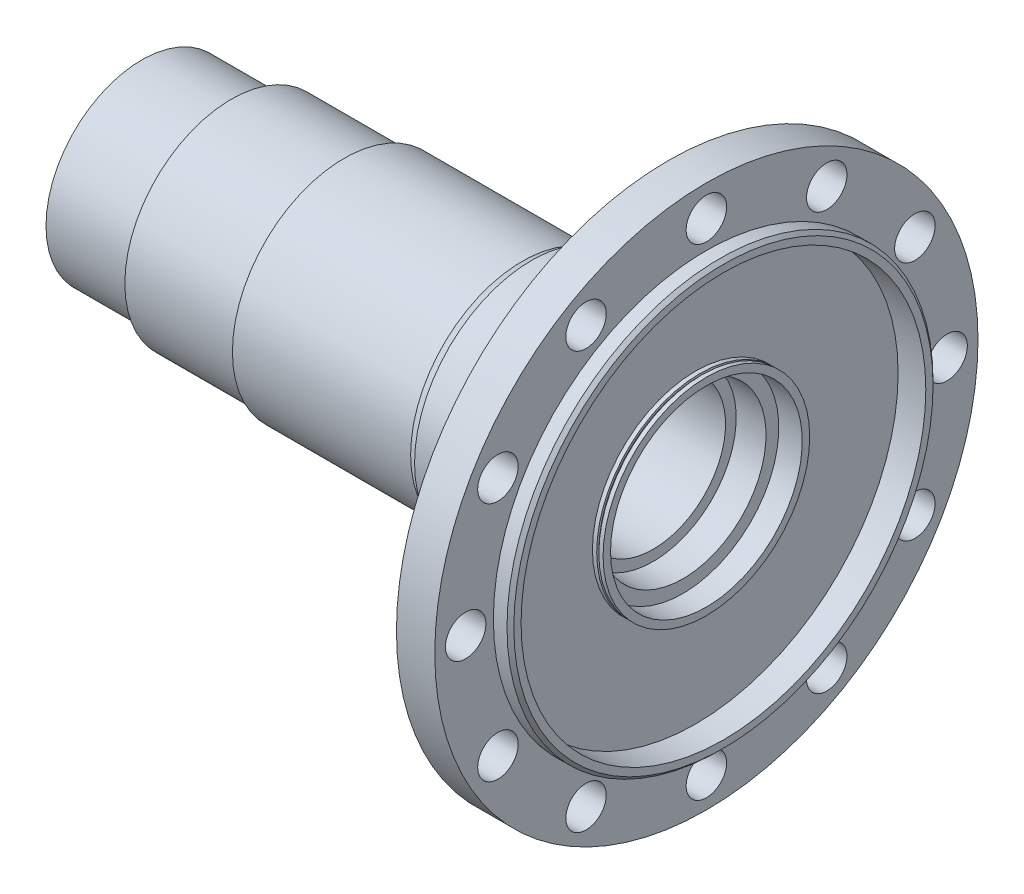
from build123d import *

# Parameters (mm, degrees)
SKETCH_3_W           = 2
SKETCH_3_H           = 46.5
SKETCH_4_W           = 1
SKETCH_4_H           = 47.5
SKETCH_5_W           = 2
SKETCH_5_H           = 46.5
SKETCH_6_R           = 9.5
CUT_EXTRUDE_1_DEPTH  = 328.171973127
SKETCH_7_R           = 9.5
CUT_EXTRUDE_2_DEPTH  = 328.171973127
SKETCH_8_R           = 9.5
CUT_EXTRUDE_3_DEPTH  = 328.171973127
SKETCH_9_R           = 9.5
CUT_EXTRUDE_4_DEPTH  = 328.171973127
SKETCH_10_R          = 9.5
CUT_EXTRUDE_5_DEPTH  = 328.171973127
SKETCH_11_R          = 9.5
CUT_EXTRUDE_6_DEPTH  = 328.171973127
SKETCH_12_R          = 9.5
CUT_EXTRUDE_7_DEPTH  = 328.171973127
SKETCH_13_R          = 9.5
CUT_EXTRUDE_8_DEPTH  = 328.171973127
SKETCH_14_R          = 9.5
CUT_EXTRUDE_9_DEPTH  = 328.171973127
SKETCH_15_R          = 9.5
CUT_EXTRUDE_10_DEPTH = 328.171973127
SKETCH_16_R          = 9.5
CUT_EXTRUDE_11_DEPTH = 328.171973127
SKETCH_17_R          = 9.5
CUT_EXTRUDE_12_DEPTH = 328.171973127


with BuildPart() as part:
    # Эскиз1 → Повернуть1 (revolve)
    with BuildSketch(Plane.XY, mode=Mode.PRIVATE) as revolve_1_sk:
        Polygon((0, 0), (273, 0), (273, 98.4), (271.4, 100), (265, 100), (265, 127.5), (247, 127.5), (247, 100), (239, 100), (239, 62.5), (215, 62.5), (215, 55), (183, 55), (178.669872981, 52.5), (95, 52.5), (95, 50), (42, 50), (42, 45), (0, 45), align=None)
    revolve(revolve_1_sk.sketch.rotate(Axis((0, 0, 0), (1, 0, 0)), 90), axis=Axis((0, 0, 0), (1, 0, 0)))

    # Эскиз2 → Вырез-Повернуть1 (revolve, cut)
    with BuildSketch(Plane.XY, mode=Mode.PRIVATE) as cut_revolve_1_sk:
        Polygon((0, 0), (273, 0), (273, 95), (265, 95), (265, 45), (254, 45), (254, 39), (240, 39), (240, 34), (203.5, 34), (203.5, 31), (0, 31), align=None)
    revolve(cut_revolve_1_sk.sketch.rotate(Axis((0, 0, 0), (1, 0, 0)), 90), axis=Axis((0, 0, 0), (1, 0, 0)), mode=Mode.SUBTRACT)

    # Эскиз3 → Rear_recess_left (revolve, cut)
    with BuildSketch(Plane.XY, mode=Mode.PRIVATE) as rear_recess_left_sk:
        with Locations((261, 71.75)):
            Rectangle(SKETCH_3_W, SKETCH_3_H)
    revolve(rear_recess_left_sk.sketch.rotate(Axis((0, 0, 0), (1, 0, 0)), 90), axis=Axis((0, 0, 0), (1, 0, 0)), mode=Mode.SUBTRACT)

    # Эскиз4 → Collar_groove_nominal (revolve, cut)
    with BuildSketch(Plane.XY, mode=Mode.PRIVATE) as collar_groove_nominal_sk:
        with Locations((262.5, 71.25)):
            Rectangle(SKETCH_4_W, SKETCH_4_H)
    revolve(collar_groove_nominal_sk.sketch.rotate(Axis((0, 0, 0), (1, 0, 0)), 90), axis=Axis((0, 0, 0), (1, 0, 0)), mode=Mode.SUBTRACT)

    # Эскиз5 → Rear_recess_lip (revolve, cut)
    with BuildSketch(Plane.XY, mode=Mode.PRIVATE) as rear_recess_lip_sk:
        with Locations((264, 71.75)):
            Rectangle(SKETCH_5_W, SKETCH_5_H)
    revolve(rear_recess_lip_sk.sketch.rotate(Axis((0, 0, 0), (1, 0, 0)), 90), axis=Axis((0, 0, 0), (1, 0, 0)), mode=Mode.SUBTRACT)

    # Эскиз6 → Вырез-Вытянуть1 (cut, through all)
    with BuildSketch(Plane(origin=(0, 0, 0), x_dir=(0, 0, -1), z_dir=(1, 0, 0))):
        with Locations(Location((0, 113, 0), (0, 0, 180))):
            Circle(SKETCH_6_R)
    extrude(amount=CUT_EXTRUDE_1_DEPTH, mode=Mode.SUBTRACT)

    # Эскиз7 → Вырез-Вытянуть2 (cut, through all)
    with BuildSketch(Plane(origin=(0, 0, 0), x_dir=(0, 0, -1), z_dir=(1, 0, 0))):
        with Locations(Location((-56.5, 97.860870628, 0), (0, 0, 180))):
            Circle(SKETCH_7_R)
    extrude(amount=CUT_EXTRUDE_2_DEPTH, mode=Mode.SUBTRACT)

    # Эскиз8 → Вырез-Вытянуть3 (cut, through all)
    with BuildSketch(Plane(origin=(0, 0, 0), x_dir=(0, 0, -1), z_dir=(1, 0, 0))):
        with Locations(Location((-97.860870628, 56.5, 0), (0, 0, 180))):
            Circle(SKETCH_8_R)
    extrude(amount=CUT_EXTRUDE_3_DEPTH, mode=Mode.SUBTRACT)

    # Эскиз9 → Вырез-Вытянуть4 (cut, through all)
    with BuildSketch(Plane(origin=(0, 0, 0), x_dir=(0, 0, -1), z_dir=(1, 0, 0))):
        with Locations(Location((-113, 0, 0), (0, 0, 180))):
            Circle(SKETCH_9_R)
    extrude(amount=CUT_EXTRUDE_4_DEPTH, mode=Mode.SUBTRACT)

    # Эскиз10 → Вырез-Вытянуть5 (cut, through all)
    with BuildSketch(Plane(origin=(0, 0, 0), x_dir=(0, 0, -1), z_dir=(1, 0, 0))):
        with Locations(Location((-97.860870628, -56.5, 0), (0, 0, 180))):
            Circle(SKETCH_10_R)
    extrude(amount=CUT_EXTRUDE_5_DEPTH, mode=Mode.SUBTRACT)

    # Эскиз11 → Вырез-Вытянуть6 (cut, through all)
    with BuildSketch(Plane(origin=(0, 0, 0), x_dir=(0, 0, -1), z_dir=(1, 0, 0))):
        with Locations(Location((-56.5, -97.860870628, 0), (0, 0, 180))):
            Circle(SKETCH_11_R)
    extrude(amount=CUT_EXTRUDE_6_DEPTH, mode=Mode.SUBTRACT)

    # Эскиз12 → Вырез-Вытянуть7 (cut, through all)
    with BuildSketch(Plane(origin=(0, 0, 0), x_dir=(0, 0, -1), z_dir=(1, 0, 0))):
        with Locations(Location((0, -113, 0), (0, 0, 180))):
            Circle(SKETCH_12_R)
    extrude(amount=CUT_EXTRUDE_7_DEPTH, mode=Mode.SUBTRACT)

    # Эскиз13 → Вырез-Вытянуть8 (cut, through all)
    with BuildSketch(Plane(origin=(0, 0, 0), x_dir=(0, 0, -1), z_dir=(1, 0, 0))):
        with Locations(Location((56.5, -97.860870628, 0), (0, 0, 180))):
            Circle(SKETCH_13_R)
    extrude(amount=CUT_EXTRUDE_8_DEPTH, mode=Mode.SUBTRACT)

    # Эскиз14 → Вырез-Вытянуть9 (cut, through all)
    with BuildSketch(Plane(origin=(0, 0, 0), x_dir=(0, 0, -1), z_dir=(1, 0, 0))):
        with Locations(Location((97.860870628, -56.5, 0), (0, 0, 180))):
            Circle(SKETCH_14_R)
    extrude(amount=CUT_EXTRUDE_9_DEPTH, mode=Mode.SUBTRACT)

    # Эскиз15 → Вырез-Вытянуть10 (cut, through all)
    with BuildSketch(Plane(origin=(0, 0, 0), x_dir=(0, 0, -1), z_dir=(1, 0, 0))):
        with Locations(Location((113, 0, 0), (0, 0, 180))):
            Circle(SKETCH_15_R)
    extrude(amount=CUT_EXTRUDE_10_DEPTH, mode=Mode.SUBTRACT)

    # Эскиз16 → Вырез-Вытянуть11 (cut, through all)
    with BuildSketch(Plane(origin=(0, 0, 0), x_dir=(0, 0, -1), z_dir=(1, 0, 0))):
        with Locations(Location((97.860870628, 56.5, 0), (0, 0, 180))):
            Circle(SKETCH_16_R)
    extrude(amount=CUT_EXTRUDE_11_DEPTH, mode=Mode.SUBTRACT)

    # Эскиз17 → Вырез-Вытянуть12 (cut, through all)
    with BuildSketch(Plane(origin=(0, 0, 0), x_dir=(0, 0, -1), z_dir=(1, 0, 0))):
        with Locations(Location((56.5, 97.860870628, 0), (0, 0, 180))):
            Circle(SKETCH_17_R)
    extrude(amount=CUT_EXTRUDE_12_DEPTH, mode=Mode.SUBTRACT)


solid = part.part
